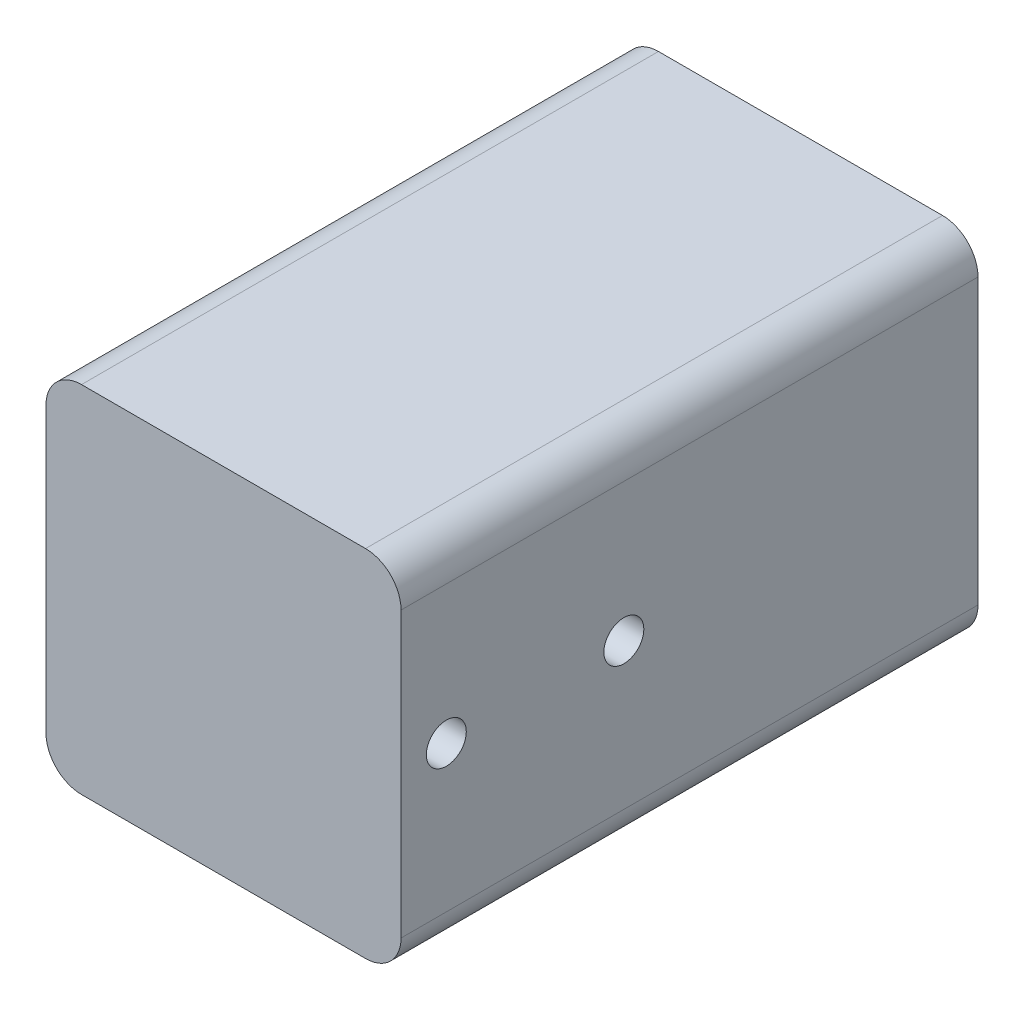
from build123d import *

# Parameters (mm, degrees)
BOSS_EXTRUDE1_DEPTH      = 65
SKETCH2_R                = 0.512371799
CUT_EXTRUDE1_DEPTH       = 3
M6_CLEARANCE_HOLE1_D     = 6.6
M6_CLEARANCE_HOLE1_DEPTH = 5
M6_CLEARANCE_HOLE1_TIP   = 1.982840043
M4_CLEARANCE_HOLE1_D     = 4.5
M4_CLEARANCE_HOLE1_DEPTH = 5
M4_CLEARANCE_HOLE1_TIP   = 1.351936393


with BuildPart() as part:
    # Sketch1 → Boss-Extrude1 (new body)
    with BuildSketch(Plane.XY):
        with BuildLine():
            Line((-16, -20), (16, -20))
            ThreePointArc((16, -20), (18.828427125, -18.828427125), (20, -16))
            Line((20, -16), (20, 16))
            ThreePointArc((20, 16), (18.828427125, 18.828427125), (16, 20))
            Line((16, 20), (-16, 20))
            ThreePointArc((-16, 20), (-18.828427125, 18.828427125), (-20, 16))
            Line((-20, 16), (-20, -16))
            ThreePointArc((-20, -16), (-18.828427125, -18.828427125), (-16, -20))
        make_face()
    extrude(amount=BOSS_EXTRUDE1_DEPTH)

    # Sketch2 → Cut-Extrude1 (cut)
    with BuildSketch(Plane(origin=(0, 0, 0), x_dir=(-1, 0, 0), z_dir=(0, 0, -1))):
        with Locations((-12.374368671, 12.374368671)):
            Circle(SKETCH2_R)
        with Locations((12.374368671, 12.374368671)):
            Circle(SKETCH2_R)
        with Locations((12.374368671, -12.374368671)):
            Circle(SKETCH2_R)
        with Locations((-12.374368671, -12.374368671)):
            Circle(SKETCH2_R)
    extrude(amount=-CUT_EXTRUDE1_DEPTH, mode=Mode.SUBTRACT)

    # M6 Clearance Hole1
    with Locations(Plane(origin=(0, 0, 0), x_dir=(-1, 0, 0), z_dir=(0, 0, -1))):
        with Locations((12.374368671, 12.374368671), (-12.374368671, 12.374368671), (-12.374368671, -12.374368671), (12.374368671, -12.374368671)):
            Hole(M6_CLEARANCE_HOLE1_D / 2, depth=M6_CLEARANCE_HOLE1_DEPTH)
            with Locations((0, 0, -(M6_CLEARANCE_HOLE1_DEPTH + M6_CLEARANCE_HOLE1_TIP / 2))):  # 118° drill point
                Cone(0, M6_CLEARANCE_HOLE1_D / 2, M6_CLEARANCE_HOLE1_TIP, mode=Mode.SUBTRACT)

    # M4 Clearance Hole1
    with Locations(Plane(origin=(20, 0, 0), x_dir=(0, 0, -1), z_dir=(1, 0, 0))):
        with Locations((-59.899999999, 0.460499028), (-39.899999999, 0.460499028)):
            Hole(M4_CLEARANCE_HOLE1_D / 2, depth=M4_CLEARANCE_HOLE1_DEPTH)
            with Locations((0, 0, -(M4_CLEARANCE_HOLE1_DEPTH + M4_CLEARANCE_HOLE1_TIP / 2))):  # 118° drill point
                Cone(0, M4_CLEARANCE_HOLE1_D / 2, M4_CLEARANCE_HOLE1_TIP, mode=Mode.SUBTRACT)


solid = part.part
